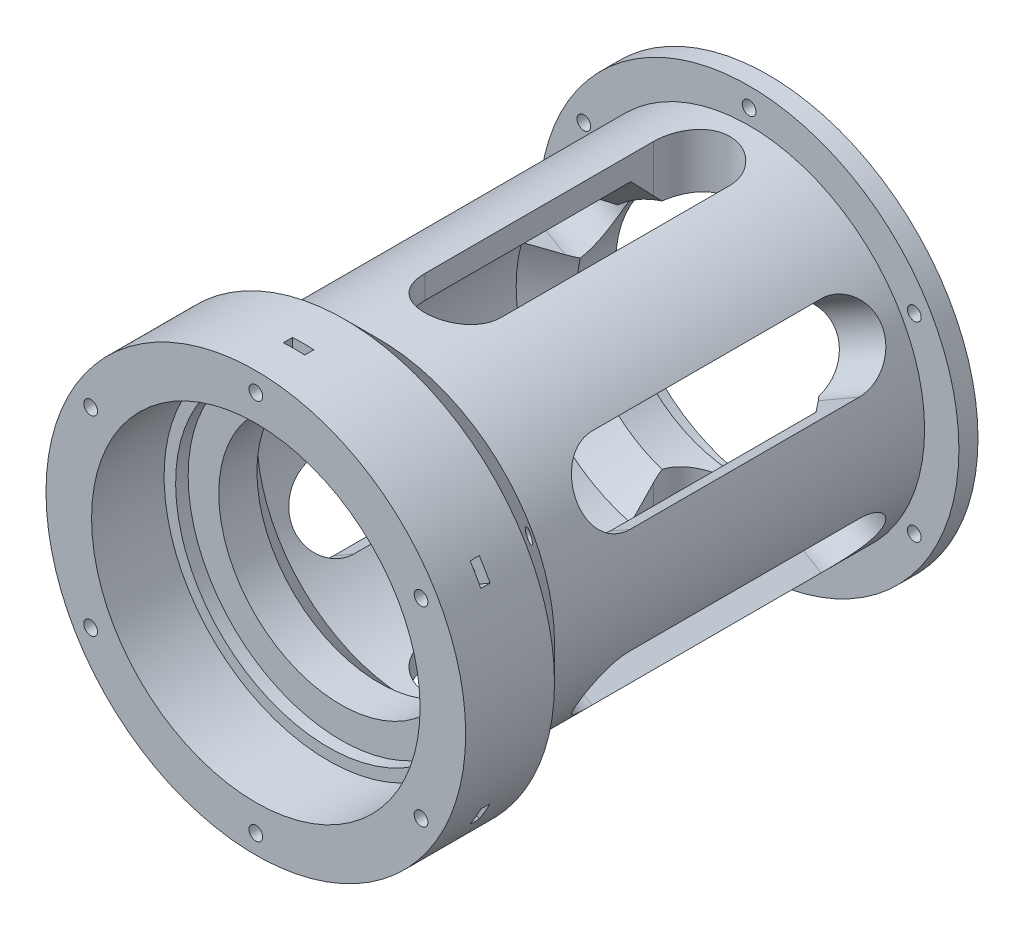
from build123d import *

# Parameters (mm, degrees)
SKETCH3_R           = 1.8
CUT_EXTRUDE1_DEPTH  = 156.180921508
BOSS_EXTRUDE1_START = 5
BOSS_EXTRUDE1_DEPTH = 5
SKETCH5_W           = 5.6
SKETCH5_H           = 11.131010483
CUT_EXTRUDE2_DEPTH  = 2.4
CUT_EXTRUDE3_DEPTH  = 156.180921579
CIRPATTERN1_COUNT   = 3


with BuildPart() as part:
    # Sketch2 → Revolve1 (revolve)
    with BuildSketch(Plane(origin=(0, 0, 0), x_dir=(1, 0, 0), z_dir=(0, 1, 0))):
        Polygon((55, 0), (40.025, 0), (40.025, -8), (32, -8), (32, -18), (40.025, -26.025), (40.025, -93.975), (32, -102), (32, -112), (40.025, -112), (40.025, -115.28), (43.05, -115.28), (43.05, -134.28), (55, -134.28), (55, -111), (46, -102), (46, -5), (55, -5), align=None)
    revolve(axis=Axis((0, 0, 164.117462422), (0, 0, -1)))

    # Sketch3 → Cut-Extrude1 (cut, through all)
    with BuildSketch(Plane.XY.offset(134.28)):
        with Locations((0, 50)):
            Circle(SKETCH3_R)
        with Locations((43.301270189, 25)):
            Circle(SKETCH3_R)
        with Locations((43.301270189, -25)):
            Circle(SKETCH3_R)
        with Locations((0, -50)):
            Circle(SKETCH3_R)
        with Locations((-43.301270189, -25)):
            Circle(SKETCH3_R)
        with Locations((-43.301270189, 25)):
            Circle(SKETCH3_R)
    extrude(amount=-CUT_EXTRUDE1_DEPTH, mode=Mode.SUBTRACT)

    # Sketch4 → Boss-Extrude1 (add)
    with BuildSketch(Plane.XY.offset(115.28).offset(BOSS_EXTRUDE1_START)):
        with BuildLine():
            ThreePointArc((2.45, 42.980228012), (0, 43.05), (-2.45, 42.980228012))
            Line((-2.45, 42.980228012), (-2.45, 39.949945244))
            ThreePointArc((-2.45, 39.949945244), (0, 40.025), (2.45, 39.949945244))
            Line((2.45, 39.949945244), (2.45, 42.980228012))
        make_face()
    extrude(amount=-BOSS_EXTRUDE1_DEPTH)

    # Sketch5 → Cut-Extrude2 (cut)
    with BuildSketch(Plane.XY.offset(124.28)):
        with Locations((0, 52.765505242)):
            Rectangle(SKETCH5_W, SKETCH5_H)
        Polygon((51.916136906, 26.740634111), (49.116136906, 31.590376372), (39.476399059, 26.024871131), (42.276399059, 21.175128869), align=None)
        Polygon((49.116136906, -31.590376372), (51.916136906, -26.740634111), (42.276399059, -21.175128869), (39.476399059, -26.024871131), align=None)
        with Locations((0, -52.765505242)):
            Rectangle(SKETCH5_W, SKETCH5_H)
        Polygon((-51.916136906, -26.740634111), (-49.116136906, -31.590376372), (-39.476399059, -26.024871131), (-42.276399059, -21.175128869), align=None)
        Polygon((-49.116136906, 31.590376372), (-51.916136906, 26.740634111), (-42.276399059, 21.175128869), (-39.476399059, 26.024871131), align=None)
    extrude(amount=-CUT_EXTRUDE2_DEPTH, mode=Mode.SUBTRACT)

    # Sketch6 → Cut-Extrude3 (cut, symmetric)
    with BuildSketch(Plane(origin=(0, 0, 0), x_dir=(1, 0, 0), z_dir=(0, 1, 0))):
        with BuildLine():
            Line((-10, -20), (-10, -80))
            ThreePointArc((-10, -80), (0, -90), (10, -80))
            Line((10, -80), (10, -20))
            ThreePointArc((10, -20), (0, -10), (-10, -20))
        make_face()
    cut_extrude3 = extrude(amount=CUT_EXTRUDE3_DEPTH, both=True, mode=Mode.SUBTRACT)

    # CirPattern1: Cut-Extrude3 ×3 about axis
    cirpattern1_axis = Axis((0, 0, 0), (0, 0, 1))
    for i in range(1, CIRPATTERN1_COUNT):
        add(cut_extrude3.rotate(cirpattern1_axis, i * 360 / CIRPATTERN1_COUNT), mode=Mode.SUBTRACT)


solid = part.part
